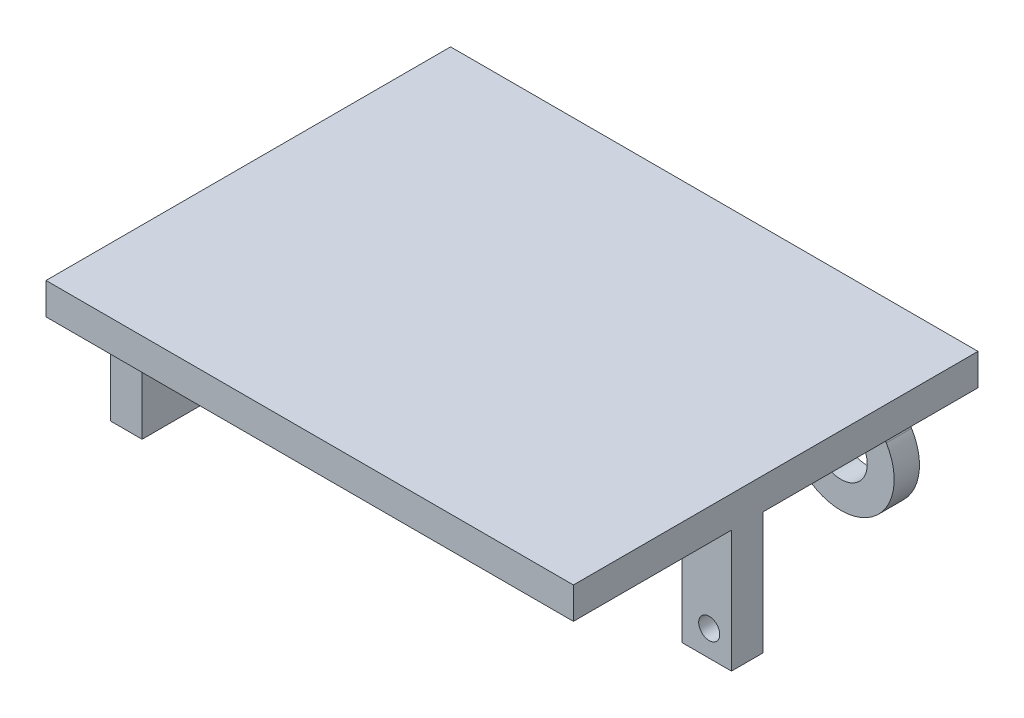
from build123d import *

# Parameters (mm, degrees)
ESQUISSE1_R        = 2.5
BOSS_EXTRU_1_DEPTH = 2.4
ESQUISSE4_W        = 50.056999207
ESQUISSE4_H        = 2.995999995
BOSS_EXTRU_2_DEPTH = 36
BOSS_EXTRU_3_START = -15
ESQUISSE5_W        = 4.7
ESQUISSE5_H        = 11.59
ESQUISSE5_R        = 1
ESQUISSE5_W_2      = 7
ESQUISSE5_H_2      = 11.59300438
BOSS_EXTRU_3_DEPTH = 3
ESQUISSE6_W        = 6.951967
ESQUISSE6_H        = 11.62400213
BOSS_EXTRU_4_DEPTH = 3


with BuildPart() as part:
    # Esquisse1 → Boss.-Extru.1 (new body)
    with BuildSketch(Plane.XY):
        with BuildLine():
            Line((-39.447248325, 12.128903773), (10.609750882, 12.128903773))
            Line((10.609750882, 12.128903773), (10.609750882, 9.132903778))
            Line((10.609750882, 9.132903778), (0.375600944, 9.132903778))
            Line((0.375600944, 9.132903778), (4.304312905, 2.649911034))
            ThreePointArc((4.304312905, 2.649911034), (3.248571469, -3.872456776), (-3.358011614, -3.777948659))
            Line((-3.358011614, -3.777948659), (-13.470694005, 9.132903778))
            Line((-13.470694005, 9.132903778), (-39.447248325, 9.132903778))
            Line((-39.447248325, 9.132903778), (-39.447248325, 12.128903773))
        make_face()
        Circle(ESQUISSE1_R, mode=Mode.SUBTRACT)
    extrude(amount=BOSS_EXTRU_1_DEPTH)

    # Esquisse4 → Boss.-Extru.2 (add)
    with BuildSketch(Plane.XY.offset(2.4)):
        with Locations((-14.418748722, 10.630903776)):
            Rectangle(ESQUISSE4_W, ESQUISSE4_H)
    extrude(amount=BOSS_EXTRU_2_DEPTH)

    # Esquisse5 → Boss.-Extru.3 (add)
    # profile 1 of 2: a face of its own
    with BuildSketch(Plane.XY.offset(38.4).offset(BOSS_EXTRU_3_START)):
        with Locations((8.259750882, 3.337903778)):
            Rectangle(ESQUISSE5_W, ESQUISSE5_H)
        with Locations((8.5, 0)):
            Circle(ESQUISSE5_R, mode=Mode.SUBTRACT)
    # profile 2 of 2: a face of its own
    with BuildSketch(Plane.XY.offset(38.4).offset(BOSS_EXTRU_3_START)):
        with Locations((-21.190248118, 3.336401588)):
            Rectangle(ESQUISSE5_W_2, ESQUISSE5_H_2)
        with Locations((-19.5, 0)):
            Circle(ESQUISSE5_R, mode=Mode.SUBTRACT)
    extrude(amount=-BOSS_EXTRU_3_DEPTH)

    # Esquisse6 → Boss.-Extru.4 (add)
    with BuildSketch(Plane(origin=(-39.447248325, 0, -39.447248325), x_dir=(0, 0, -1), z_dir=(1, 0, 0))):
        with Locations((-49.047247825, 3.320902713)):
            Rectangle(ESQUISSE6_W, ESQUISSE6_H)
        with Locations((-68.247248825, 3.320902713)):
            Rectangle(ESQUISSE6_W, ESQUISSE6_H)
    extrude(amount=BOSS_EXTRU_4_DEPTH)


solid = part.part
